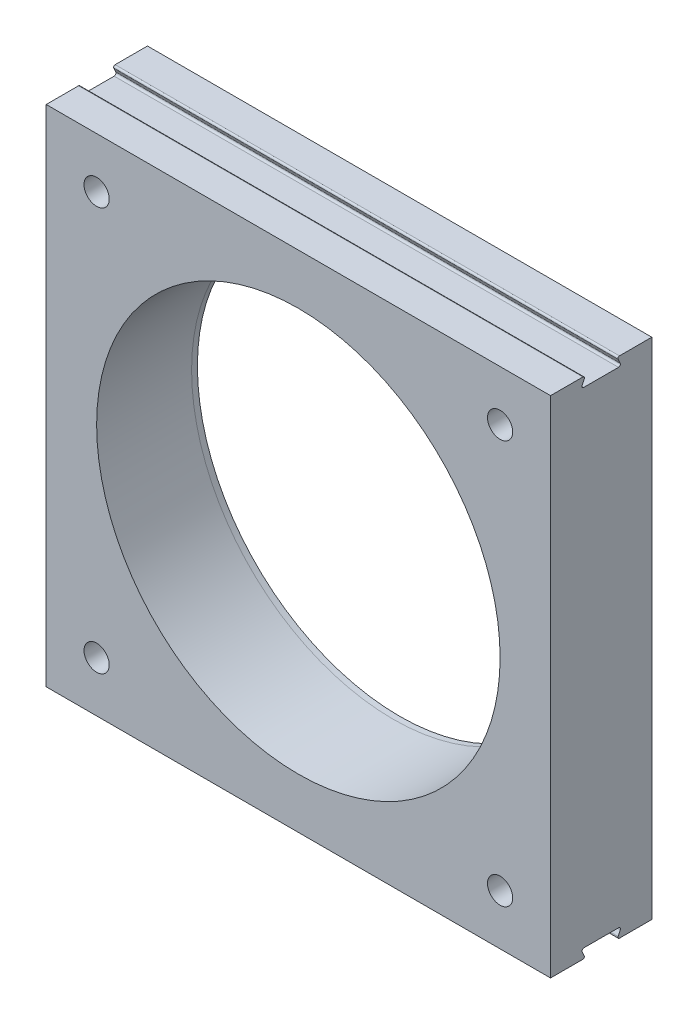
from build123d import *

# Parameters (mm, degrees)
SKETCH1_W               = 254
SKETCH1_H               = 254
BASE_EXTRUDE_DEPTH      = 25.5
FILLET4_R               = 0.79375
FILLET4_OF_MIRROR3_R    = 0.79375
SKETCH4_R               = 6.35
CUT_EXTRUDE1_DEPTH      = 187.705650691
MIRROR2_COPY_1_SKETCH_R = 6.35
MIRROR2_COPY_1_DEPTH    = 187.705650691
SKETCH5_R               = 101.85
SKETCH5_R_2             = 101.6
CUT_EXTRUDE2_DEPTH      = 3.175
SKETCH7_R               = 101.6
CUT_EXTRUDE3_DEPTH      = 187.705650691


with BuildPart() as part:
    # Sketch1 → Base-Extrude (new, symmetric)
    with BuildSketch(Plane.XY):
        Rectangle(SKETCH1_W, SKETCH1_H)
    extrude(amount=BASE_EXTRUDE_DEPTH, both=True)

    # Cut-Sweep1: sweep along a path in Sketch3
    with BuildLine(Plane.XY) as cut_sweep1_path:
        Line((127, 127), (-127, 127))
    # Sketch2 → Cut-Sweep1 (sweep, cut)
    with BuildSketch(Plane(origin=(127, 0, 0), x_dir=(0, 0, -1), z_dir=(1, 0, 0))):
        with BuildLine():
            Line((-7.9375, 127), (7.9375, 127))
            Line((7.9375, 127), (9.590397866, 123.612719875))
            ThreePointArc((9.590397866, 123.612719875), (9.542015805, 122.686966067), (8.73125, 122.2375))
            Line((8.73125, 122.2375), (-8.73125, 122.2375))
            ThreePointArc((-8.73125, 122.2375), (-9.542015805, 122.686966067), (-9.590397866, 123.612719875))
            Line((-9.590397866, 123.612719875), (-7.9375, 127))
        make_face()
    cut_sweep1 = sweep(path=cut_sweep1_path.line, mode=Mode.SUBTRACT)

    # Fillet4
    fillet4_edges = [part.edges().sort_by_distance(p)[0] for p in [
        (0, 127, 7.9375),
        (0, 127, -7.9375),
    ]]
    fillet(fillet4_edges, radius=FILLET4_R)

    # Mirror3: Cut-Sweep1 across plane
    add(cut_sweep1.mirror(Plane.ZX), mode=Mode.SUBTRACT)

    # Fillet4 of Mirror3
    fillet4_of_mirror3_edges = [part.edges().sort_by_distance(p)[0] for p in [
        (0, -127, 7.9375),
        (0, -127, -7.9375),
    ]]
    fillet(fillet4_of_mirror3_edges, radius=FILLET4_OF_MIRROR3_R)

    # Sketch4 → Cut-Extrude1 (cut, through all)
    with BuildSketch(Plane.XY.offset(25.5)):
        with Locations((-101.6, 101.6)):
            Circle(SKETCH4_R)
    cut_extrude1 = extrude(amount=-CUT_EXTRUDE1_DEPTH, mode=Mode.SUBTRACT)

    # Mirror1: Cut-Extrude1 across plane
    add(cut_extrude1.mirror(Plane.ZX), mode=Mode.SUBTRACT)

    # Mirror2: Cut-Extrude1 across plane
    add(cut_extrude1.mirror(Plane(origin=(0, 0, 0), x_dir=(0, 0, 1), z_dir=(1, 0, 0))), mode=Mode.SUBTRACT)

    # Mirror2 copy 1 sketch → Mirror2 copy 1 (cut, through all)
    with BuildSketch(Plane(origin=(0, 0, 25.5), x_dir=(-1, 0, 0), z_dir=(0, 0, 1))):
        with Locations((-101.6, 101.6)):
            Circle(MIRROR2_COPY_1_SKETCH_R)
    extrude(amount=-MIRROR2_COPY_1_DEPTH, mode=Mode.SUBTRACT)

    # Sketch5 → Cut-Extrude2 (cut)
    with BuildSketch(Plane(origin=(0, 0, -25.5), x_dir=(-1, 0, 0), z_dir=(0, 0, -1))):
        Circle(SKETCH5_R)
        Circle(SKETCH5_R_2, mode=Mode.SUBTRACT)
    extrude(amount=-CUT_EXTRUDE2_DEPTH, mode=Mode.SUBTRACT)

    # Sketch7 → Cut-Extrude3 (cut, through all)
    with BuildSketch(Plane(origin=(0, 0, -25.5), x_dir=(-1, 0, 0), z_dir=(0, 0, -1))):
        Circle(SKETCH7_R)
    extrude(amount=-CUT_EXTRUDE3_DEPTH, mode=Mode.SUBTRACT)


solid = part.part
